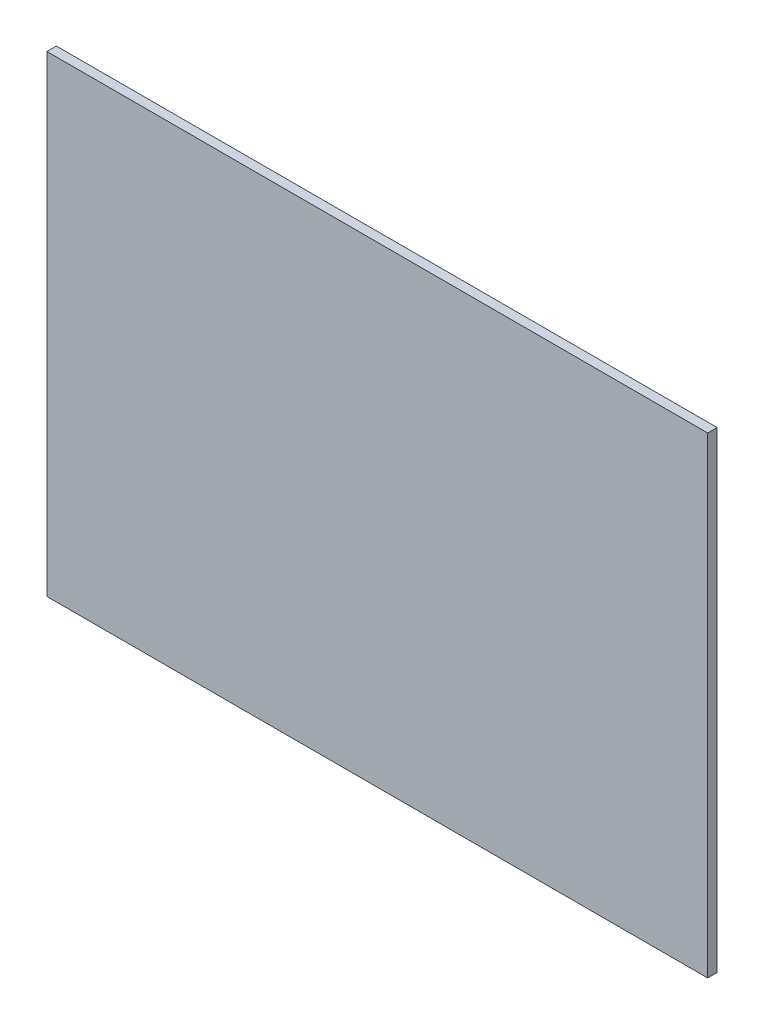
from build123d import *

# Parameters (mm, degrees)
SKETCH3_W           = 210
SKETCH3_H           = 150
BOSS_EXTRUDE3_DEPTH = 3


with BuildPart() as part:
    # Sketch3 → Boss-Extrude3 (new body)
    with BuildSketch(Plane.XY):
        with Locations((56.698645522, -91.038012074)):
            Rectangle(SKETCH3_W, SKETCH3_H)
    extrude(amount=-BOSS_EXTRUDE3_DEPTH)


solid = part.part
